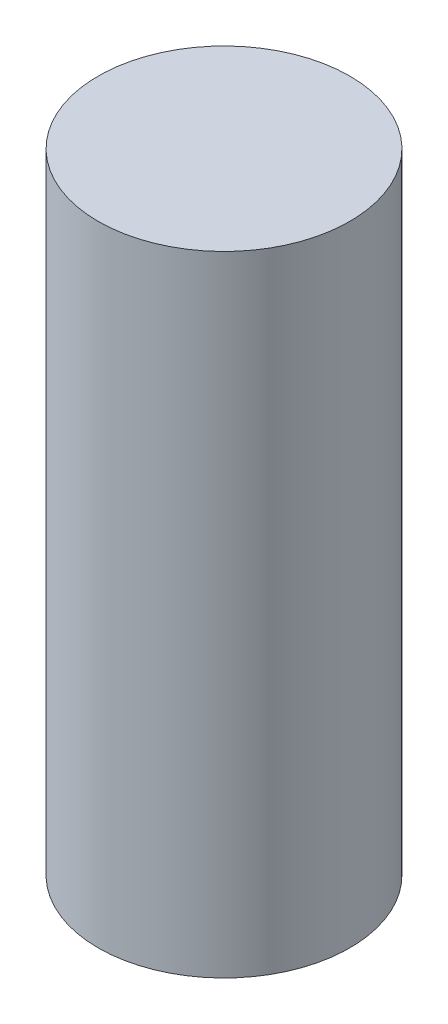
from build123d import *

# Parameters (mm, degrees)
SKETCH1_R           = 30
BOSS_EXTRUDE1_DEPTH = 150


with BuildPart() as part:
    # Sketch1 → Boss-Extrude1 (new body)
    with BuildSketch(Plane(origin=(0, 0, 0), x_dir=(1, 0, 0), z_dir=(0, 1, 0))):
        with Locations(Location((0, 0, 0), (0, 0, 270))):
            Circle(SKETCH1_R)
    extrude(amount=BOSS_EXTRUDE1_DEPTH)


solid = part.part
